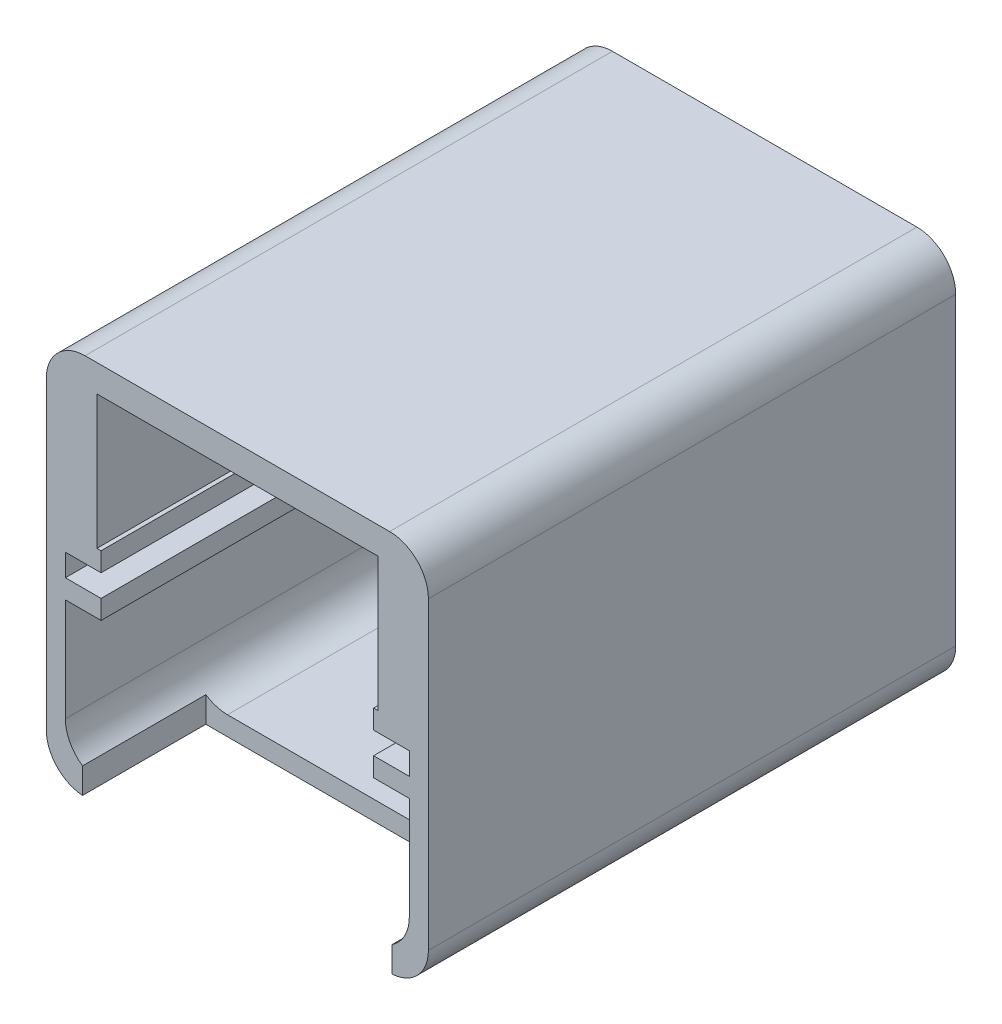
from build123d import *

# Parameters (mm, degrees)
SKETCH1_W            = 100
SKETCH1_H            = 100
BOSS_EXTRUDE1_DEPTH  = 250
SKETCH2_W            = 90
SKETCH2_H            = 90
CUT_EXTRUDE1_DEPTH   = 288.228132327
FILLET1_R            = 10.16
SKETCH3_W            = 9.3412
SKETCH3_H            = 5
BOSS_EXTRUDE2_DEPTH  = 250
SKETCH4_W            = 100
SKETCH4_H            = 125
CUT_EXTRUDE2_DEPTH   = 288.228132327
SKETCH6_W            = 90
SKETCH6_H            = 5.08
BOSS_EXTRUDE3_DEPTH  = 95
SKETCH7_R            = 45.3
CUT_EXTRUDE4_DEPTH   = 5.08
SKETCH10_R           = 48.300000047
BOSS_EXTRUDE4_DEPTH  = 30
SKETCH11_R           = 45.3
CUT_EXTRUDE5_DEPTH   = 30
SKETCH13_W           = 63.5
SKETCH13_H           = 63.5
CUT_EXTRUDE7_DEPTH   = 5
FILLET4_R            = 1.27
FILLET5_R            = 10.16
BOSS_EXTRUDE6_DEPTH  = 30
SKETCH16_R           = 45.3
CUT_EXTRUDE8_DEPTH   = 189.745860882
CUT_EXTRUDE10_DEPTH  = 210.821352584
SKETCH19_W           = 81
SKETCH19_H           = 64.77
CUT_EXTRUDE11_DEPTH  = 25.4
SKETCH20_W           = 81
SKETCH20_H           = 32.5
BOSS_EXTRUDE7_DEPTH  = 5
BOSS_EXTRUDE8_START  = 32.5
BOSS_EXTRUDE8_DEPTH  = 32.5
BOSS_EXTRUDE10_DEPTH = 119.92
SKETCH25_W           = 73.5
SKETCH25_H           = 16.413635584
BOSS_EXTRUDE11_DEPTH = 6.35
SKETCH26_W           = 17
SKETCH26_H           = 125.184112418
CUT_EXTRUDE12_DEPTH  = 288.228132327


with BuildPart() as part:
    # Sketch1 → Boss-Extrude1 (new body)
    with BuildSketch(Plane.XY):
        with Locations((50, 50)):
            Rectangle(SKETCH1_W, SKETCH1_H)
    extrude(amount=BOSS_EXTRUDE1_DEPTH)

    # Sketch2 → Cut-Extrude1 (cut, through all)
    with BuildSketch(Plane(origin=(0, 0, 0), x_dir=(-1, 0, 0), z_dir=(0, 0, -1))):
        with Locations((-50, 50)):
            Rectangle(SKETCH2_W, SKETCH2_H)
    extrude(amount=-CUT_EXTRUDE1_DEPTH, mode=Mode.SUBTRACT)

    # Fillet1
    fillet1_edges = [part.edges().sort_by_distance(p)[0] for p in [
        (0, 100, 125),
        (0, 0, 125),
        (100, 0, 125),
        (100, 100, 125),
    ]]
    fillet(fillet1_edges, radius=FILLET1_R)

    # Sketch3 → Boss-Extrude2 (add, through all)
    with BuildSketch(Plane(origin=(0, 0, 0), x_dir=(-1, 0, 0), z_dir=(0, 0, -1))):
        with Locations((-90.3294, 55.4)):
            Rectangle(SKETCH3_W, SKETCH3_H)
        with Locations((-90.3294, 44.6)):
            Rectangle(SKETCH3_W, SKETCH3_H)
        with Locations((-9.6706, 44.6)):
            Rectangle(SKETCH3_W, SKETCH3_H)
        with Locations((-9.6706, 55.4)):
            Rectangle(SKETCH3_W, SKETCH3_H)
    extrude(amount=-BOSS_EXTRUDE2_DEPTH)

    # Sketch4 → Cut-Extrude2 (cut, through all)
    with BuildSketch(Plane(origin=(0, 100, 0), x_dir=(1, 0, 0), z_dir=(0, 1, 0))):
        with Locations((50, -62.5)):
            Rectangle(SKETCH4_W, SKETCH4_H)
    extrude(amount=-CUT_EXTRUDE2_DEPTH, mode=Mode.SUBTRACT)

    # Sketch6 → Boss-Extrude3 (add)
    with BuildSketch(Plane(origin=(0, 5, 0), x_dir=(1, 0, 0), z_dir=(0, 1, 0))):
        with Locations((50, -127.54)):
            Rectangle(SKETCH6_W, SKETCH6_H)
    extrude(amount=BOSS_EXTRUDE3_DEPTH)

    # Sketch7 → Cut-Extrude4 (cut)
    with BuildSketch(Plane(origin=(0, 0, 125), x_dir=(-1, 0, 0), z_dir=(0, 0, -1))):
        with Locations((-50, 50)):
            Circle(SKETCH7_R)
    extrude(amount=-CUT_EXTRUDE4_DEPTH, mode=Mode.SUBTRACT)

    # Sketch10 → Boss-Extrude4 (add)
    with BuildSketch(Plane(origin=(0, 0, 125), x_dir=(-1, 0, 0), z_dir=(0, 0, -1))):
        with Locations(Location((-50, 50, 0), (0, 0, 180))):
            Circle(SKETCH10_R)
    extrude(amount=BOSS_EXTRUDE4_DEPTH)

    # Sketch11 → Cut-Extrude5 (cut)
    with BuildSketch(Plane(origin=(0, 0, 95), x_dir=(-1, 0, 0), z_dir=(0, 0, -1))):
        with Locations((-50, 50)):
            Circle(SKETCH11_R)
    extrude(amount=-CUT_EXTRUDE5_DEPTH, mode=Mode.SUBTRACT)

    # Sketch13 → Cut-Extrude7 (cut)
    with BuildSketch(Plane.XZ):
        with Locations((50, 218.25)):
            Rectangle(SKETCH13_W, SKETCH13_H)
    extrude(amount=-CUT_EXTRUDE7_DEPTH, mode=Mode.SUBTRACT)

    # Fillet4
    fillet4_edges = [part.edges().sort_by_distance(p)[0] for p in [
        (81.75, 0, 218.25),
        (18.25, 0, 218.25),
        (50, 0, 186.5),
    ]]
    fillet(fillet4_edges, radius=FILLET4_R)

    # Fillet5
    fillet5_edges = [part.edges().sort_by_distance(p)[0] for p in [
        (95, 95, 190.04),
        (5, 95, 190.04),
        (5, 5, 190.04),
        (95, 5, 190.04),
    ]]
    fillet(fillet5_edges, radius=FILLET5_R)

    # Sketch14 → Boss-Extrude6 (add)
    with BuildSketch(Plane(origin=(0, 0, 125), x_dir=(-1, 0, 0), z_dir=(0, 0, -1))):
        with BuildLine():
            Line((-5, 100), (-95, 100))
            Line((-95, 100), (-95, 98.592142595))
            ThreePointArc((-95, 98.592142595), (-98.661881885, 94.879841267), (-100, 89.84))
            Line((-100, 89.84), (-100, 10.16))
            ThreePointArc((-100, 10.16), (-97.024204897, 2.975795103), (-89.84, 0))
            Line((-89.84, 0), (-10.16, 0))
            ThreePointArc((-10.16, 0), (-2.975795103, 2.975795103), (0, 10.16))
            Line((0, 10.16), (0, 89.84))
            ThreePointArc((0, 89.84), (-1.338118115, 94.879841267), (-5, 98.592142595))
            Line((-5, 98.592142595), (-5, 100))
        make_face()
    extrude(amount=BOSS_EXTRUDE6_DEPTH)

    # Sketch16 → Cut-Extrude8 (cut, through all)
    with BuildSketch(Plane.XY.offset(125)):
        with Locations(Location((50, 50, 0), (0, 0, 169.956667322))):
            Circle(SKETCH16_R)
    extrude(amount=-CUT_EXTRUDE8_DEPTH, mode=Mode.SUBTRACT)

    # Sketch18 → Cut-Extrude10 (cut, through all)
    with BuildSketch(Plane(origin=(0, 0, 95), x_dir=(-1, 0, 0), z_dir=(0, 0, -1))):
        with BuildLine():
            Line((-100, 89.84), (-100, 107.62))
            Line((-100, 107.62), (0, 107.62))
            Line((0, 107.62), (0, 89.84))
            ThreePointArc((0, 89.84), (-2.975795103, 97.024204897), (-10.16, 100))
            Line((-10.16, 100), (-89.84, 100))
            ThreePointArc((-89.84, 100), (-97.024204897, 97.024204897), (-100, 89.84))
        make_face()
    extrude(amount=-CUT_EXTRUDE10_DEPTH, mode=Mode.SUBTRACT)

    # Sketch19 → Cut-Extrude11 (cut)
    with BuildSketch(Plane.XZ):
        with Locations((50, 217.615)):
            Rectangle(SKETCH19_W, SKETCH19_H)
    extrude(amount=-CUT_EXTRUDE11_DEPTH, mode=Mode.SUBTRACT)

    # Sketch20 → Boss-Extrude7 (add)
    with BuildSketch(Plane.XZ):
        with Locations((50, 201.48)):
            Rectangle(SKETCH20_W, SKETCH20_H)
    extrude(amount=-BOSS_EXTRUDE7_DEPTH)

    # Sketch21 → Boss-Extrude8 (add)
    with BuildSketch(Plane.XY.offset(185.23).offset(BOSS_EXTRUDE8_START)):
        with BuildLine():
            Line((9.5, 5), (15.16, 5))
            ThreePointArc((15.16, 5), (12.201837845, 5.440181243), (9.5, 6.722583334))
            Line((9.5, 6.722583334), (9.5, 5))
        make_face()
        with BuildLine():
            ThreePointArc((90.5, 6.722583334), (87.798162155, 5.440181243), (84.84, 5))
            Line((84.84, 5), (90.5, 5))
            Line((90.5, 5), (90.5, 6.722583334))
        make_face()
    extrude(amount=-BOSS_EXTRUDE8_DEPTH)

    # Sketch24 → Boss-Extrude10 (add)
    with BuildSketch(Plane.XY.offset(130.08)):
        Polygon((95, 57.9), (86.75, 57.9), (86.75, 92.9), (13.25, 92.9), (13.25, 57.9), (5, 57.9), (5, 95), (95, 95), align=None)
    extrude(amount=BOSS_EXTRUDE10_DEPTH)

    # Sketch25 → Boss-Extrude11 (add)
    with BuildSketch(Plane.XY.offset(130.08)):
        with Locations((50, 84.693182208)):
            Rectangle(SKETCH25_W, SKETCH25_H)
    extrude(amount=BOSS_EXTRUDE11_DEPTH)

    # Sketch26 → Cut-Extrude12 (cut, through all)
    with BuildSketch(Plane(origin=(100, 0, 0), x_dir=(0, 0, -1), z_dir=(1, 0, 0))):
        with Locations((-103.5, 50.164427468)):
            Rectangle(SKETCH26_W, SKETCH26_H)
    extrude(amount=-CUT_EXTRUDE12_DEPTH, mode=Mode.SUBTRACT)


solid = part.part
